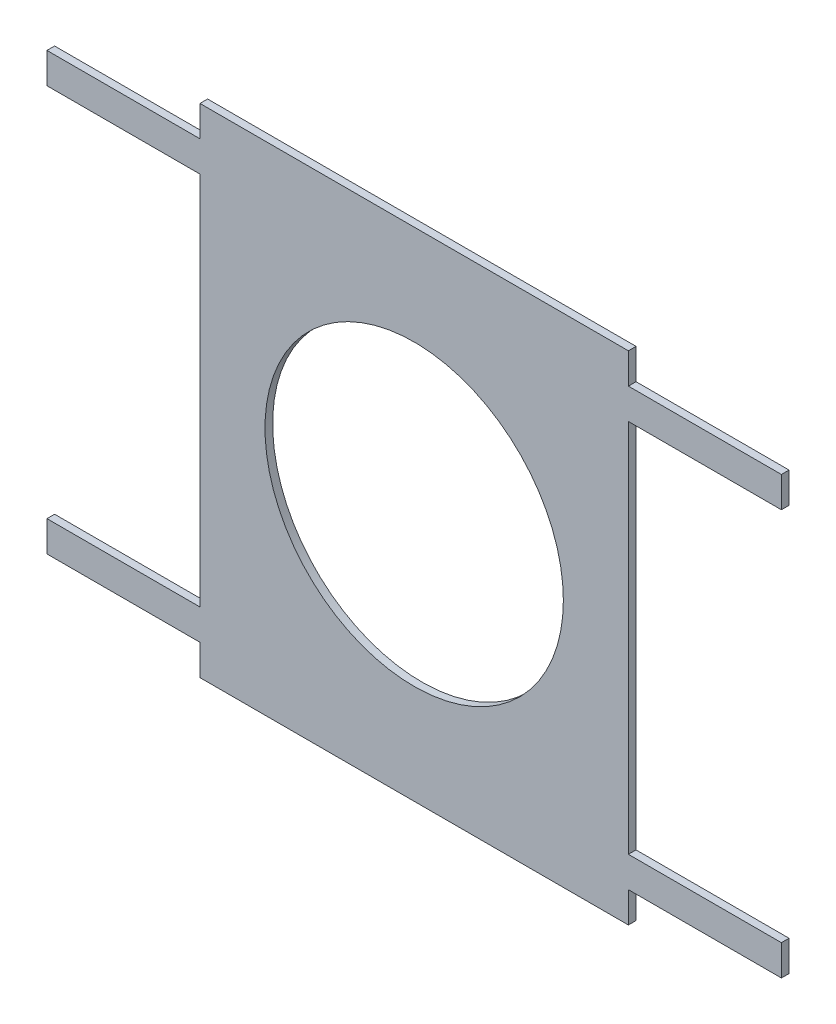
from build123d import *

# Parameters (mm, degrees)
SKETCH1_W           = 2.8
SKETCH1_H           = 3.25
SKETCH1_R           = 0.975
SKETCH1_W_2         = 1
SKETCH1_H_2         = 0.2
BOSS_EXTRUDE1_DEPTH = 0.05


with BuildPart() as part:
    # Sketch1 → Boss-Extrude1 (new body)
    # profile 1 of 5: a face of its own
    with BuildSketch(Plane.XY):
        Rectangle(SKETCH1_W, SKETCH1_H)
        Circle(SKETCH1_R, mode=Mode.SUBTRACT)
    # profile 2 of 5: a face of its own
    with BuildSketch(Plane.XY):
        with Locations((-1.9, -1.325)):
            Rectangle(SKETCH1_W_2, SKETCH1_H_2)
    # profile 3 of 5: a face of its own
    with BuildSketch(Plane.XY):
        with Locations((1.9, -1.325)):
            Rectangle(SKETCH1_W_2, SKETCH1_H_2)
    # profile 4 of 5: a face of its own
    with BuildSketch(Plane.XY):
        with Locations((1.9, 1.325)):
            Rectangle(SKETCH1_W_2, SKETCH1_H_2)
    # profile 5 of 5: a face of its own
    with BuildSketch(Plane.XY):
        with Locations((-1.9, 1.325)):
            Rectangle(SKETCH1_W_2, SKETCH1_H_2)
    extrude(amount=BOSS_EXTRUDE1_DEPTH)


solid = part.part
